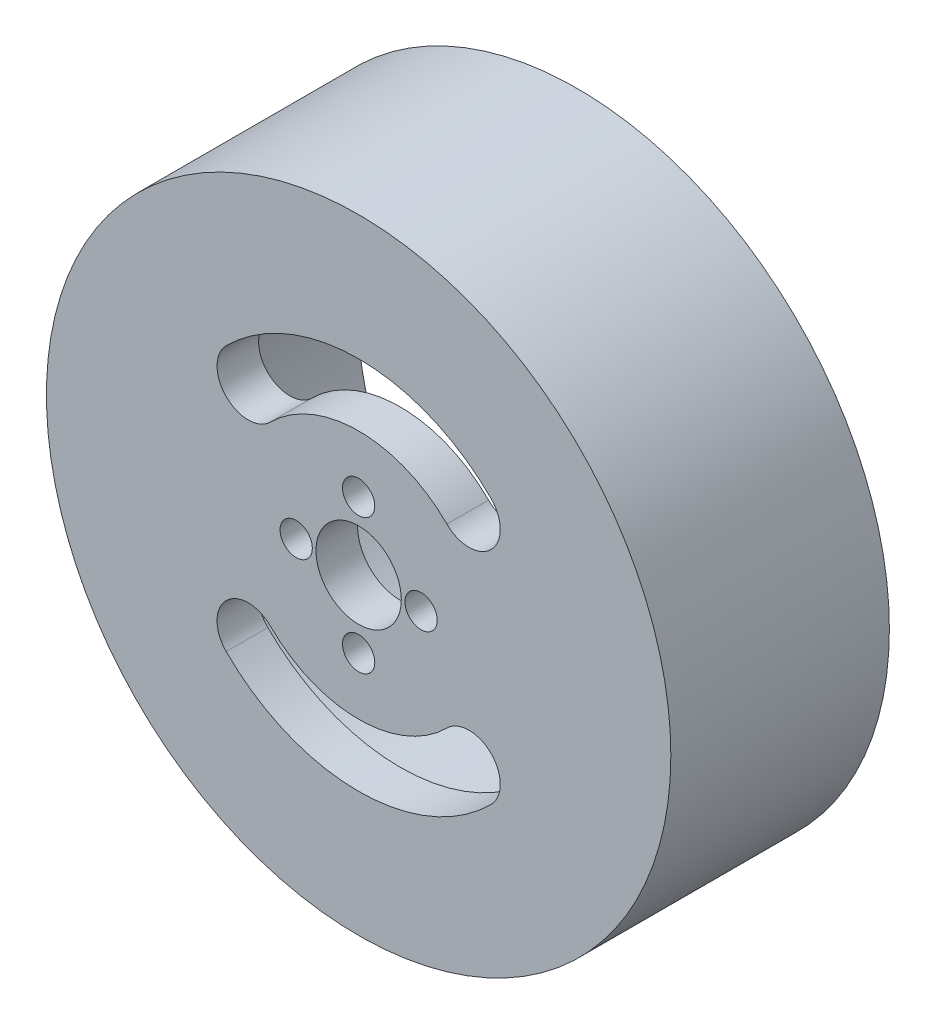
from build123d import *

# Parameters (mm, degrees)
SKETCH1_R           = 30
BOSS_EXTRUDE1_DEPTH = 4
BOSS_EXTRUDE2_START = -17
BOSS_EXTRUDE2_DEPTH = 17


with BuildPart() as part:
    # Sketch1 → Boss-Extrude1 (new body)
    with BuildSketch(Plane.XY):
        Circle(SKETCH1_R)
        with BuildLine():
            ThreePointArc((-12.727922061, -12.727922061), (0, -18), (12.727922061, -12.727922061))
            ThreePointArc((12.727922061, -12.727922061), (13.378240315, -9.458551421), (10.606601718, -7.606601718))
            ThreePointArc((10.606601718, -7.606601718), (9.458551421, -7.83496312), (8.485281374, -8.485281374))
            ThreePointArc((8.485281374, -8.485281374), (0, -12), (-8.485281374, -8.485281374))
            ThreePointArc((-8.485281374, -8.485281374), (-9.458551421, -7.83496312), (-10.606601718, -7.606601718))
            ThreePointArc((-10.606601718, -7.606601718), (-13.378240315, -9.458551421), (-12.727922061, -12.727922061))
        make_face(mode=Mode.SUBTRACT)
        with BuildLine():
            ThreePointArc((8.485281374, 8.485281374), (12.727922061, 8.485281374), (12.727922061, 12.727922061))
            ThreePointArc((12.727922061, 12.727922061), (6.888301783, 16.629831585), (0, 18))
            ThreePointArc((0, 18), (-6.888301783, 16.629831585), (-12.727922061, 12.727922061))
            ThreePointArc((-12.727922061, 12.727922061), (-12.727922061, 8.485281374), (-8.485281374, 8.485281374))
            ThreePointArc((-8.485281374, 8.485281374), (-4.592201188, 11.08655439), (0, 12))
            ThreePointArc((0, 12), (4.592201188, 11.08655439), (8.485281374, 8.485281374))
        make_face(mode=Mode.SUBTRACT)
        with BuildLine():
            ThreePointArc((0, -4.95), (-1.55, -6.5), (0, -8.05))
            ThreePointArc((0, -8.05), (1.55, -6.5), (0, -4.95))
        make_face(mode=Mode.SUBTRACT)
        with BuildLine():
            ThreePointArc((6, 1.55), (4.45, 0), (6, -1.55))
            ThreePointArc((6, -1.55), (7.55, 0), (6, 1.55))
        make_face(mode=Mode.SUBTRACT)
        with BuildLine():
            ThreePointArc((-6, 1.55), (-7.55, 0), (-6, -1.55))
            ThreePointArc((-6, -1.55), (-4.45, 0), (-6, 1.55))
        make_face(mode=Mode.SUBTRACT)
        with BuildLine():
            ThreePointArc((0, 4.95), (1.55, 6.5), (0, 8.05))
            ThreePointArc((0, 8.05), (-1.55, 6.5), (0, 4.95))
        make_face(mode=Mode.SUBTRACT)
        with BuildLine():
            ThreePointArc((0, 4.1), (-4.1, 0), (0, -4.1))
            ThreePointArc((0, -4.1), (4.1, 0), (0, 4.1))
        make_face(mode=Mode.SUBTRACT)
    extrude(amount=-BOSS_EXTRUDE1_DEPTH)

    # Sketch2 → Boss-Extrude2 (add)
    with BuildSketch(Plane(origin=(0, 0, -21), x_dir=(-1, 0, 0), z_dir=(0, 0, -1)).offset(BOSS_EXTRUDE2_START)):
        with BuildLine():
            ThreePointArc((0, -30), (30, 0), (0, 30))
            ThreePointArc((0, 30), (-30, 0), (0, -30))
        make_face()
        with BuildLine():
            ThreePointArc((0, 21), (-21, 0), (0, -21))
            ThreePointArc((0, -21), (21, 0), (0, 21))
        make_face(mode=Mode.SUBTRACT)
    extrude(amount=BOSS_EXTRUDE2_DEPTH)


solid = part.part
